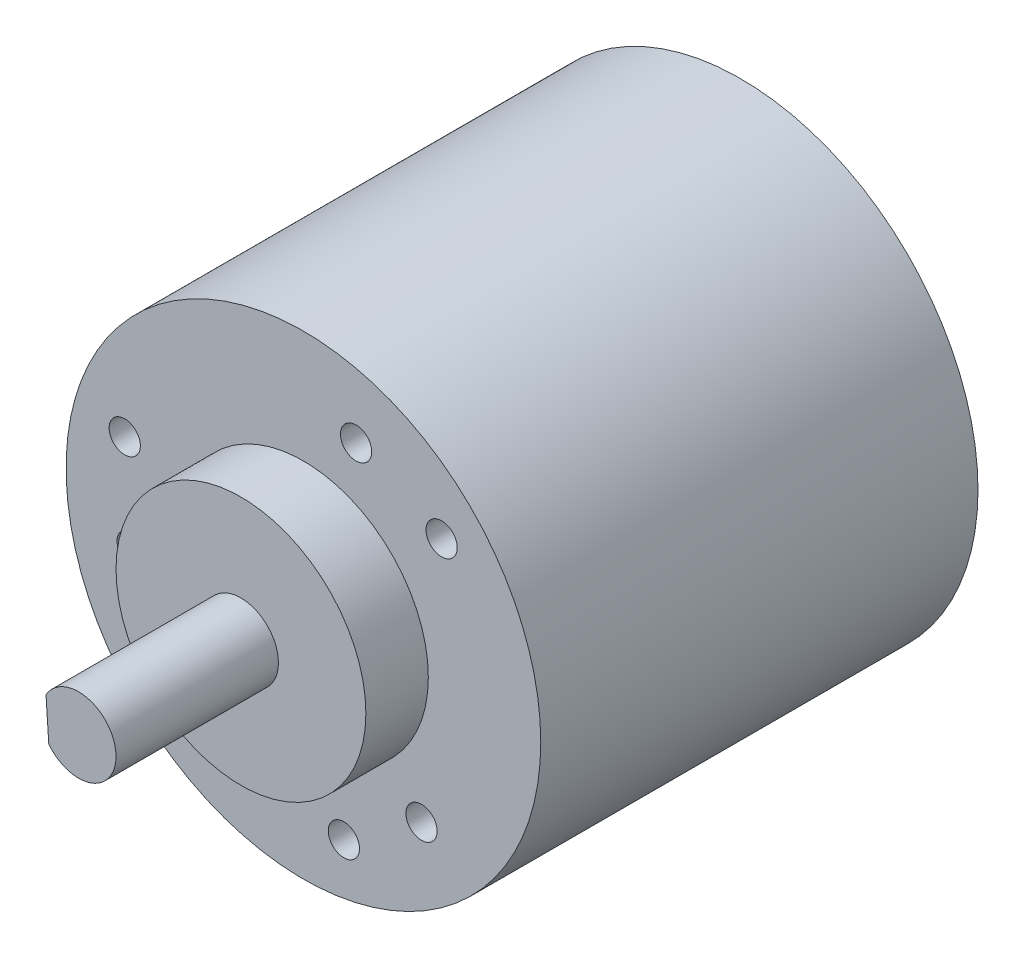
from build123d import *

# Parameters (mm, degrees)
ESQUISSE1_R             = 19
BOSS_EXTRU_1_DEPTH      = 35
ESQUISSE2_R             = 10
BOSS_EXTRU_2_DEPTH      = 5
ESQUISSE3_R             = 3
BOSS_EXTRU_3_DEPTH      = 13
ESQUISSE4_R             = 1.25
ENL_V_MAT_EXTRU_1_DEPTH = 8
ENL_V_MAT_EXTRU_2_DEPTH = 13


with BuildPart() as part:
    # Esquisse1 → Boss.-Extru.1 (new body)
    with BuildSketch(Plane.XY):
        Circle(ESQUISSE1_R)
    extrude(amount=BOSS_EXTRU_1_DEPTH)

    # Esquisse2 → Boss.-Extru.2 (add)
    with BuildSketch(Plane.XY.offset(35)):
        Circle(ESQUISSE2_R)
    extrude(amount=BOSS_EXTRU_2_DEPTH)

    # Esquisse3 → Boss.-Extru.3 (add)
    with BuildSketch(Plane.XY.offset(40)):
        with Locations(Location((0, 0, 0), (0, 0, 180))):
            Circle(ESQUISSE3_R)
    extrude(amount=BOSS_EXTRU_3_DEPTH)

    # Esquisse4 → Enlèv. mat.-Extru.1 (cut)
    with BuildSketch(Plane.XY.offset(35)):
        with Locations((3.239548848, -14.646000248)):
            Circle(ESQUISSE4_R)
        with Locations((9.453296275, -10.326431598)):
            Circle(ESQUISSE4_R)
        with Locations((-13.669600231, -3.023578925)):
            Circle(ESQUISSE4_R)
        with Locations((-14.303582703, 4.517468525)):
            Circle(ESQUISSE4_R)
        with Locations((4.216303956, 13.350010522)):
            Circle(ESQUISSE4_R)
        with Locations((11.064033854, 10.128531723)):
            Circle(ESQUISSE4_R)
    extrude(amount=-ENL_V_MAT_EXTRU_1_DEPTH, mode=Mode.SUBTRACT)

    # Esquisse6 → Enlèv. mat.-Extru.2 (cut)
    with BuildSketch(Plane.XY.offset(53)):
        Polygon((-2.382419019, -1.823205862), (-2.606187886, 1.485861604), (-6.139376272, 1.246937022), (-5.915607406, -2.062130444), align=None)
    extrude(amount=-ENL_V_MAT_EXTRU_2_DEPTH, mode=Mode.SUBTRACT)


solid = part.part
